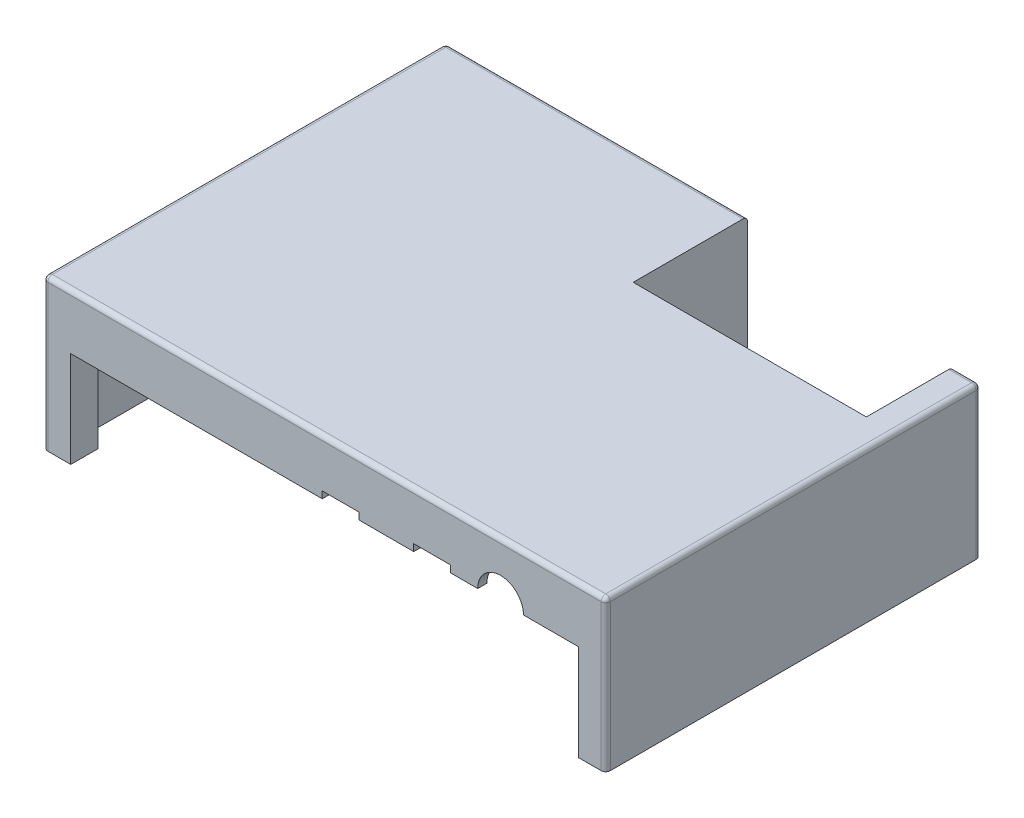
from build123d import *

# Parameters (mm, degrees)
SKETCH2_W                 = 123
SKETCH2_H                 = 88
BOSS_EXTRUDE1_DEPTH       = 2
SKETCH3_W                 = 6
SKETCH3_H                 = 6
CUT_EXTRUDE1_DEPTH        = 2
BOSS_EXTRUDE2_DEPTH       = 33
CUT_EXTRUDE2_DEPTH        = 113.317629961
CUT_EXTRUDE2_DEPTH_BACK   = 2
SKETCH5_W                 = 13
SKETCH5_H                 = 8
SKETCH5_R                 = 3
SKETCH6_W                 = 111
SKETCH6_H                 = 21
CUT_EXTRUDE3_DEPTH        = 2
SKETCH7_W                 = 8
SKETCH7_H                 = 1.5
CUT_EXTRUDE4_DEPTH        = 2
F_3_0MM_DOWEL_HOLE2_D     = 3
F_3_0MM_DOWEL_HOLE2_DEPTH = 15
F_3_0MM_DOWEL_HOLE2_TIP   = 0.901290929
CUT_EXTRUDE10_DEPTH       = 2
FILLET1_R                 = 1


with BuildPart() as part:
    # Sketch2 → Boss-Extrude1 (new body)
    with BuildSketch(Plane(origin=(0, 0, 0), x_dir=(1, 0, 0), z_dir=(0, 1, 0))):
        Rectangle(SKETCH2_W, SKETCH2_H)
    extrude(amount=-BOSS_EXTRUDE1_DEPTH)

    # Sketch3 → Cut-Extrude1 (cut)
    with BuildSketch(Plane(origin=(0, 0, 0), x_dir=(1, 0, 0), z_dir=(0, 1, 0))):
        Polygon((55.5, 38), (55.5, 44), (4.5, 44), (4.5, 19), (55.5, 19), align=None)
        with Locations((58.5, 41)):
            Rectangle(SKETCH3_W, SKETCH3_H)
    extrude(amount=-CUT_EXTRUDE1_DEPTH, mode=Mode.SUBTRACT)

    # Sketch4 → Boss-Extrude2 (add)
    with BuildSketch(Plane(origin=(0, 0, 0), x_dir=(1, 0, 0), z_dir=(0, 1, 0))):
        Polygon((59.5, -38), (55.5, -38), (55.5, -42), (-55.5, -42), (-55.5, -38), (-59.5, -38), (-59.5, 38), (-55.5, 38), (-55.5, 42), (2.5, 42), (2.5, 17), (55.5, 17), (55.5, 19), (4.5, 19), (4.5, 44), (-61.5, 44), (-61.5, -44), (61.5, -44), (61.5, 38), (55.5, 38), (55.5, 32), (59.5, 32), align=None)
    extrude(amount=-BOSS_EXTRUDE2_DEPTH)

    # Sketch5 → Cut-Extrude2 (cut, two sides: drawn at the far end of the back side and taken through both)
    with BuildSketch(Plane(origin=(0, 0, -44), x_dir=(-1, 0, 0), z_dir=(0, 0, -1)).offset(-CUT_EXTRUDE2_DEPTH_BACK)):
        with Locations((17, -13)):
            Rectangle(SKETCH5_W, SKETCH5_H)
        with Locations((35.5, -12)):
            Circle(SKETCH5_R)
    extrude(amount=CUT_EXTRUDE2_DEPTH + CUT_EXTRUDE2_DEPTH_BACK, mode=Mode.SUBTRACT)

    # Sketch6 → Cut-Extrude3 (cut)
    with BuildSketch(Plane.XY.offset(44)):
        with Locations((0, -22.5)):
            Rectangle(SKETCH6_W, SKETCH6_H)
    extrude(amount=-CUT_EXTRUDE3_DEPTH, mode=Mode.SUBTRACT)

    # Sketch7 → Cut-Extrude4 (cut)
    with BuildSketch(Plane.XY.offset(44)):
        with BuildLine():
            Line((33.5, -12), (43.5, -12))
            ThreePointArc((43.5, -12), (38.5, -7), (33.5, -12))
        make_face()
        with Locations((3.5, -11.25)):
            Rectangle(SKETCH7_W, SKETCH7_H)
        with Locations((23.5, -11.25)):
            Rectangle(SKETCH7_W, SKETCH7_H)
    extrude(amount=-CUT_EXTRUDE4_DEPTH, mode=Mode.SUBTRACT)

    # Ø3.0mm Dowel Hole2
    with Locations(Plane(origin=(0, -33, 0), x_dir=(-1, 0, 0), z_dir=(0, -1, 0))):
        with Locations((58.5, -41), (58.5, 41), (-58.5, 35), (-58.5, -41)):
            Hole(F_3_0MM_DOWEL_HOLE2_D / 2, depth=F_3_0MM_DOWEL_HOLE2_DEPTH)
            with Locations((0, 0, -(F_3_0MM_DOWEL_HOLE2_DEPTH + F_3_0MM_DOWEL_HOLE2_TIP / 2))):  # 118° drill point
                Cone(0, F_3_0MM_DOWEL_HOLE2_D / 2, F_3_0MM_DOWEL_HOLE2_TIP, mode=Mode.SUBTRACT)

    # Sketch15 → Cut-Extrude10 (cut)
    with BuildSketch(Plane.ZY.offset(61.5)):
        with BuildLine():
            ThreePointArc((23, -30), (20, -27), (17, -30))
            Line((17, -30), (17, -33))
            Line((17, -33), (23, -33))
            Line((23, -33), (23, -30))
        make_face()
    extrude(amount=-CUT_EXTRUDE10_DEPTH, mode=Mode.SUBTRACT)

    # Fillet1
    fillet1_edges = [part.edges().sort_by_distance(p)[0] for p in [
        (-28.5, 0, -44),
        (61.5, -16.5, -38),
        (58.5, 0, -38),
        (0, 0, 44),
        (-61.5, 0, 0),
        (61.5, 0, 3),
        (61.5, -16.5, 44),
        (-61.5, -16.5, 44),
        (-61.5, -16.5, -44),
    ]]
    fillet(fillet1_edges, radius=FILLET1_R)


solid = part.part
